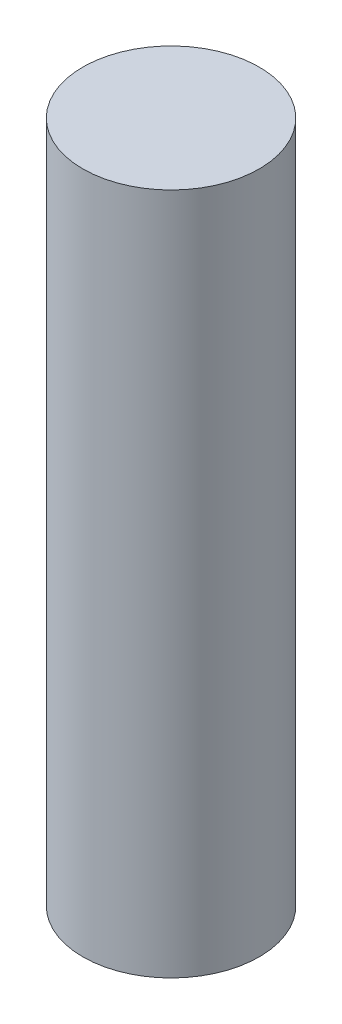
from build123d import *

# Parameters (mm, degrees)
SKETCH1_R           = 9.05
BOSS_EXTRUDE1_DEPTH = 70


with BuildPart() as part:
    # Sketch1 → Boss-Extrude1 (new body)
    with BuildSketch(Plane(origin=(0, 0, 0), x_dir=(1, 0, 0), z_dir=(0, 1, 0))):
        with Locations(Location((0, 0, 0), (0, 0, 270))):
            Circle(SKETCH1_R)
    extrude(amount=BOSS_EXTRUDE1_DEPTH)


solid = part.part
